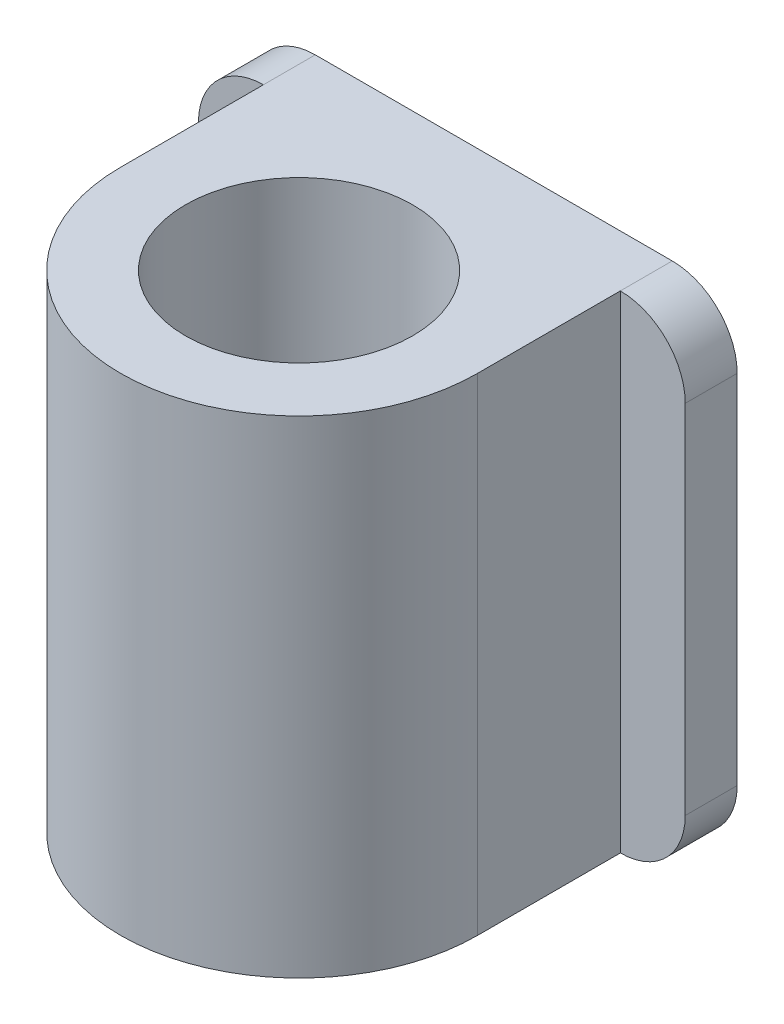
from build123d import *

# Parameters (mm, degrees)
SKETCH1_W               = 75
SKETCH1_H               = 75
BOSS_EXTRUDE1_DEPTH     = 8
FILLET1_R               = 10
SKETCH2_R               = 17.5
BOSS_EXTRUDE2_DEPTH     = 37.5
SKETCH3_R               = 17
BOSS_EXTRUDE3_DEPTH     = 200
SKETCH4_R               = 22
SKETCH4_R_2             = 17
BOSS_EXTRUDE4_DEPTH     = 10
BOSS_EXTRUDE5_DEPTH     = 50
SKETCH6_R               = 17.5
CUT_EXTRUDE1_DEPTH      = 25
SKETCH7_R               = 17.5
BOSS_EXTRUDE6_DEPTH     = 100
CUT_EXTRUDE2_DEPTH      = 235.438691346
CUT_EXTRUDE2_DEPTH_BACK = 235.438691346
SKETCH8_R               = 5.5
CUT_EXTRUDE3_DEPTH      = 258.012159245
CUT_EXTRUDE3_DEPTH_BACK = 258.012159245
SKETCH10_R              = 14
CHAMFER1_SIZE           = 5
CUT_EXTRUDE4_DEPTH      = 12
FILLET3_R               = 3
FILLET2_R               = 3


with BuildPart() as part:
    # Sketch1 → Boss-Extrude1 (new body)
    with BuildSketch(Plane.XY):
        Rectangle(SKETCH1_W, SKETCH1_H)
    extrude(amount=BOSS_EXTRUDE1_DEPTH)

    # Fillet1
    fillet1_edges = [part.edges().sort_by_distance(p)[0] for p in [
        (37.5, -37.5, 4),
        (-37.5, -37.5, 4),
        (-37.5, 37.5, 4),
        (37.5, 37.5, 4),
    ]]
    fillet(fillet1_edges, radius=FILLET1_R)

    # Sketch2 → Boss-Extrude2 (add, symmetric)
    with BuildSketch(Plane(origin=(0, 0, 0), x_dir=(1, 0, 0), z_dir=(0, 1, 0))):
        with BuildLine():
            Line((-27.5, -8), (-27.5, -30))
            ThreePointArc((-27.5, -30), (0, -57.5), (27.5, -30))
            Line((27.5, -30), (27.5, -8))
            Line((27.5, -8), (-27.5, -8))
        make_face()
        with Locations(Location((0, -30, 0), (0, 0, 270))):
            Circle(SKETCH2_R, mode=Mode.SUBTRACT)
    extrude(amount=BOSS_EXTRUDE2_DEPTH, both=True)


with BuildPart() as body_2:
    # Sketch3 → Boss-Extrude3 (new body)
    with BuildSketch(Plane(origin=(0, 37.5, 0), x_dir=(1, 0, 0), z_dir=(0, 1, 0))):
        with Locations(Location((0, -30, 0), (0, 0, 270))):
            Circle(SKETCH3_R)
    extrude(amount=-BOSS_EXTRUDE3_DEPTH)

    # Sketch4 → Boss-Extrude4 (add)
    with BuildSketch(Plane.XZ.offset(37.5)):
        with Locations(Location((0, 30, 0), (0, 0, 270))):
            Circle(SKETCH4_R)
        with Locations(Location((0, 30, 0), (0, 0, 90))):
            Circle(SKETCH4_R_2, mode=Mode.SUBTRACT)
    extrude(amount=BOSS_EXTRUDE4_DEPTH)


with BuildPart() as body_3:
    # Sketch5 → Boss-Extrude5 (new body)
    with BuildSketch(Plane.XZ.offset(162.5)):
        with BuildLine():
            Line((-8, 15), (-8, 5))
            Line((-8, 5), (-12.5, 5))
            Line((-12.5, 5), (-25, 17.5))
            Line((-25, 17.5), (-25, 82))
            Line((-25, 82), (0, 82))
            Line((0, 82), (0, 47))
            ThreePointArc((0, 47), (-16.492422502, 34.123105626), (-8, 15))
        make_face()
    extrude(amount=-BOSS_EXTRUDE5_DEPTH)

    # Mirror1: body 3 across plane


with BuildPart() as body_3_1:
    add(body_3.part)
    add(body_3.part.mirror(Plane(origin=(0, -112.5, 82), x_dir=(0, 0, 1), z_dir=(1, 0, 0))))

    # Sketch6 → Cut-Extrude1 (cut)
    with BuildSketch(Plane.XY.offset(82)):
        with Locations((0, -137.5)):
            Circle(SKETCH6_R)
    extrude(amount=-CUT_EXTRUDE1_DEPTH, mode=Mode.SUBTRACT)


with BuildPart() as body_4:
    # Sketch7 → Boss-Extrude6 (new body)
    with BuildSketch(Plane.XY.offset(57)):
        with Locations((0, -137.5)):
            Circle(SKETCH7_R)
    extrude(amount=BOSS_EXTRUDE6_DEPTH)


with BuildPart() as cut_extrude2_tool:
    # Sketch8 → Cut-Extrude2 (new, two sides: drawn at the far end of the back side and taken through both)
    with BuildSketch(Plane(origin=(25, 0, 0), x_dir=(0, 0, -1), z_dir=(1, 0, 0)).offset(-CUT_EXTRUDE2_DEPTH_BACK)):
        with Locations((-30, -137.5)):
            Circle(SKETCH8_R)
    extrude(amount=CUT_EXTRUDE2_DEPTH + CUT_EXTRUDE2_DEPTH_BACK)


with BuildPart() as body_2_1:
    add(body_2.part)

    # Cut-Extrude2: cut by cut_extrude2_tool
    add(cut_extrude2_tool.part, mode=Mode.SUBTRACT)

    # Sketch10 → Cut-Extrude3 (cut, two sides: drawn at the far end of the back side and taken through both)
    with BuildSketch(Plane.XZ.offset(162.5).offset(-CUT_EXTRUDE3_DEPTH_BACK)):
        with Locations(Location((0, 30, 0), (0, 0, 270))):
            Circle(SKETCH10_R)
    extrude(amount=CUT_EXTRUDE3_DEPTH + CUT_EXTRUDE3_DEPTH_BACK, mode=Mode.SUBTRACT)


with BuildPart() as body_3_2:
    add(body_3_1.part)

    # Cut-Extrude2: cut by cut_extrude2_tool
    add(cut_extrude2_tool.part, mode=Mode.SUBTRACT)

    # Chamfer1
    chamfer1_edges = [body_3_2.edges().sort_by_distance(p)[0] for p in [
        (25, -137.5, 35.5),
    ]]
    chamfer(chamfer1_edges, length=CHAMFER1_SIZE)

    # Sketch11 → Cut-Extrude4 (cut)
    with BuildSketch(Plane.ZY.offset(25)):
        Polygon((39, -142.696152423), (39, -132.303847577), (30, -127.107695155), (21, -132.303847577), (21, -142.696152423), (30, -147.892304845), align=None)
    extrude(amount=-CUT_EXTRUDE4_DEPTH, mode=Mode.SUBTRACT)

    # Fillet3
    fillet3_edges = [body_3_2.edges().sort_by_distance(p)[0] for p in [
        (-8, -137.5, 5),
        (-12.5, -137.5, 5),
        (-25, -137.5, 17.5),
        (8, -137.5, 5),
        (12.5, -137.5, 5),
        (25, -137.5, 17.5),
    ]]
    fillet(fillet3_edges, radius=FILLET3_R)

    # Fillet2
    fillet2_edges = [body_3_2.edges().sort_by_distance(p)[0] for p in [
        (12.40540961, -162.5, 5.228361402),
        (-12.40540961, -162.5, 5.228361402),
        (-11.128679656, -112.5, 5),
        (-8, -112.5, 11.5),
        (18.75, -112.5, 11.25),
        (11.128679656, -112.5, 5),
        (8, -112.5, 11.5),
        (-24.771638598, -112.5, 17.59459039),
        (24.771638598, -112.5, 17.59459039),
        (-8.878679656, -112.5, 5.878679656),
        (8.878679656, -112.5, 5.878679656),
        (12.40540961, -112.5, 5.228361402),
        (-12.40540961, -112.5, 5.228361402),
        (-25, -112.5, 50.371320344),
        (25, -162.5, 50.371320344),
        (25, -112.5, 50.371320344),
        (-25, -162.5, 50.371320344),
        (-18.75, -162.5, 11.25),
        (-18.75, -112.5, 11.25),
        (8, -162.5, 11.5),
        (11.128679656, -162.5, 5),
        (18.75, -162.5, 11.25),
        (-11.128679656, -162.5, 5),
        (-8, -162.5, 11.5),
        (-24.771638598, -162.5, 17.59459039),
        (24.771638598, -162.5, 17.59459039),
        (-8.878679656, -162.5, 5.878679656),
        (8.878679656, -162.5, 5.878679656),
    ]]
    fillet(fillet2_edges, radius=FILLET2_R)


solid = part.part
